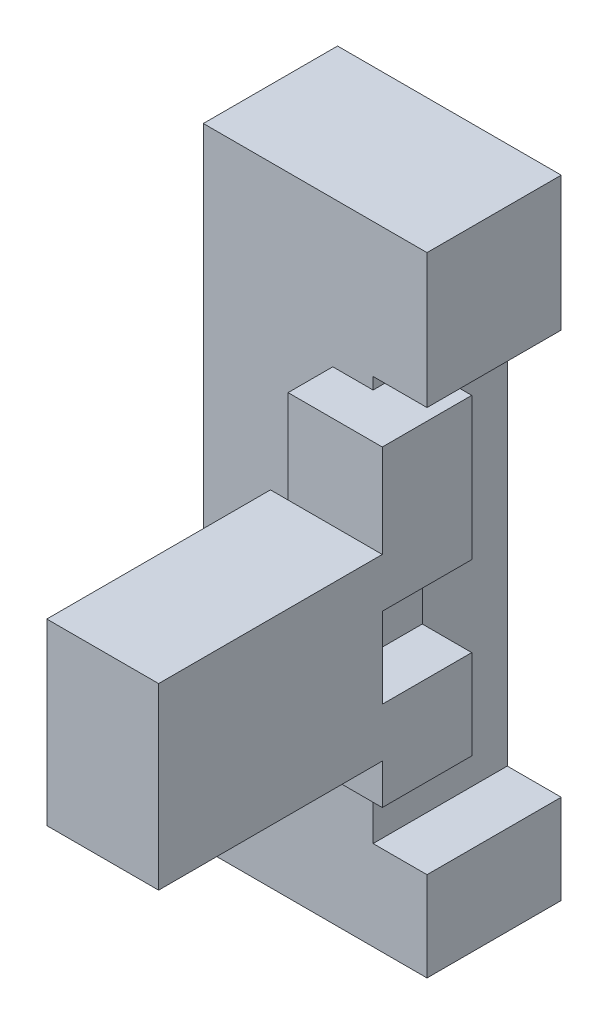
from build123d import *

# Parameters (mm, degrees)
SALIENTE_EXTRUIR1_DEPTH      = 2
CROQUIS2_W                   = 2.5
CROQUIS2_H                   = 4
SALIENTE_EXTRUIR2_DEPTH      = 5
SALIENTE_EXTRUIR3_DEPTH      = 2
SALIENTE_EXTRUIR3_DEPTH_BACK = 1


with BuildPart() as part:
    # Croquis1 → Saliente-Extruir1 (new body)
    with BuildSketch(Plane.XY):
        Polygon((44.714751496, -7.621064437), (44.114751496, -7.621064437), (44.114751496, -5.821064437), (45.220609876, -5.821064437), (45.220609876, -4.641064437), (45.220609876, -2.641064437), (43.114751496, -2.641064437), (43.114751496, -9.621064437), (44.114751496, -9.621064437), (45.220609876, -9.621064437), (45.220609876, -7.621064437), align=None)
    extrude(amount=SALIENTE_EXTRUIR1_DEPTH)

    # Croquis2 → Saliente-Extruir2 (add)
    with BuildSketch(Plane.XY.offset(2)):
        with Locations((43.970609876, -6.721064437)):
            Rectangle(CROQUIS2_W, CROQUIS2_H)
    extrude(amount=SALIENTE_EXTRUIR2_DEPTH)

    # Croquis3 → Saliente-Extruir3 (add, two sides: drawn at the far end of the back side and taken through both)
    with BuildSketch(Plane(origin=(0, 0, 0), x_dir=(-1, 0, 0), z_dir=(0, 0, -1)).offset(-SALIENTE_EXTRUIR3_DEPTH_BACK)):
        Polygon((-44.014751496, -2.37771269), (-44.014751496, -9.420966811), (-44.014751496, -11.420966811), (-45.220609876, -11.420966811), (-45.220609876, -13.420966811), (-40.220609876, -13.420966811), (-40.220609876, -12.420966811), (-40.220609876, 0.62228731), (-45.220609876, 0.62228731), (-45.220609876, -2.37771269), align=None)
    extrude(amount=SALIENTE_EXTRUIR3_DEPTH + SALIENTE_EXTRUIR3_DEPTH_BACK)


solid = part.part
